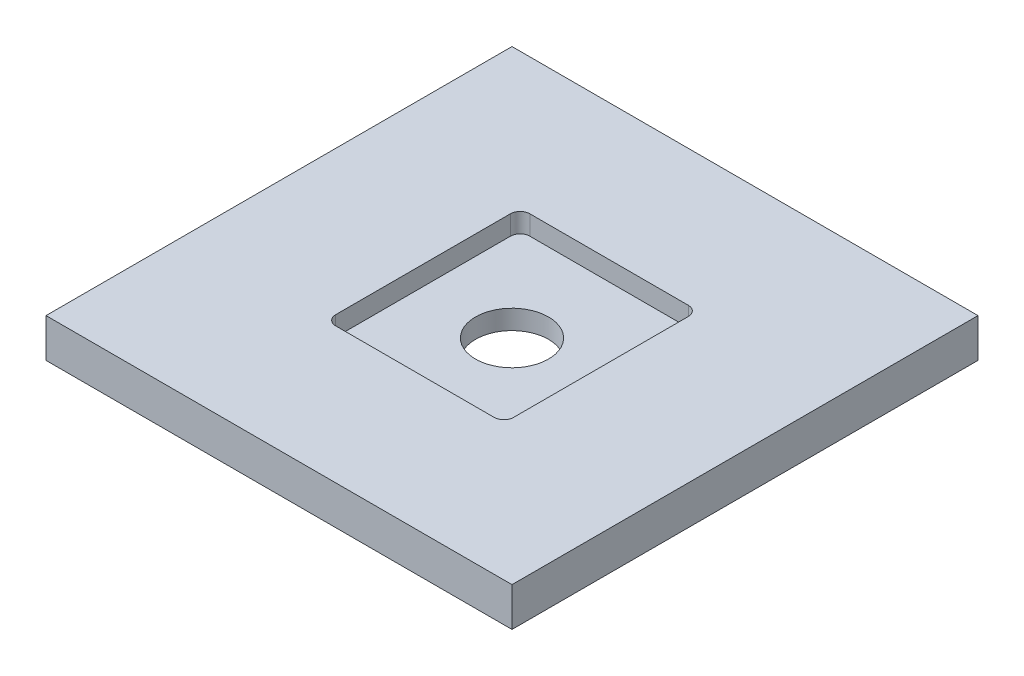
from build123d import *

# Parameters (mm, degrees)
SKETCH1_W                = 304.8
SKETCH1_H                = 304.8
SKETCH1_W_2              = 116.370630768
SKETCH1_H_2              = 127
SHEET_METAL_CUTOUT_DEPTH = 12.7
CUTOUT_FILLET_R          = 6.35
SKETCH2_W                = 304.8
SKETCH2_H                = 304.8
SKETCH2_R                = 23.876
BOSS_EXTRUDE2_DEPTH      = 12.7


with BuildPart() as part:
    # Sketch1 → Sheet metal cutout (new body)
    with BuildSketch(Plane(origin=(0, 0, 0), x_dir=(1, 0, 0), z_dir=(0, 1, 0))):
        Rectangle(SKETCH1_W, SKETCH1_H)
        Rectangle(SKETCH1_W_2, SKETCH1_H_2, mode=Mode.SUBTRACT)
    extrude(amount=SHEET_METAL_CUTOUT_DEPTH)

    # cutout fillet
    cutout_fillet_edges = [part.edges().sort_by_distance(p)[0] for p in [
        (58.185315384, 6.35, 63.5),
        (58.185315384, 6.35, -63.5),
        (-58.185315384, 6.35, -63.5),
        (-58.185315384, 6.35, 63.5),
    ]]
    fillet(cutout_fillet_edges, radius=CUTOUT_FILLET_R)

    # Sketch2 → Boss-Extrude2 (add)
    with BuildSketch(Plane.XZ):
        Rectangle(SKETCH2_W, SKETCH2_H)
        with Locations(Location((0, 0, 0), (0, 0, 270))):
            Circle(SKETCH2_R, mode=Mode.SUBTRACT)
    extrude(amount=BOSS_EXTRUDE2_DEPTH)


solid = part.part
